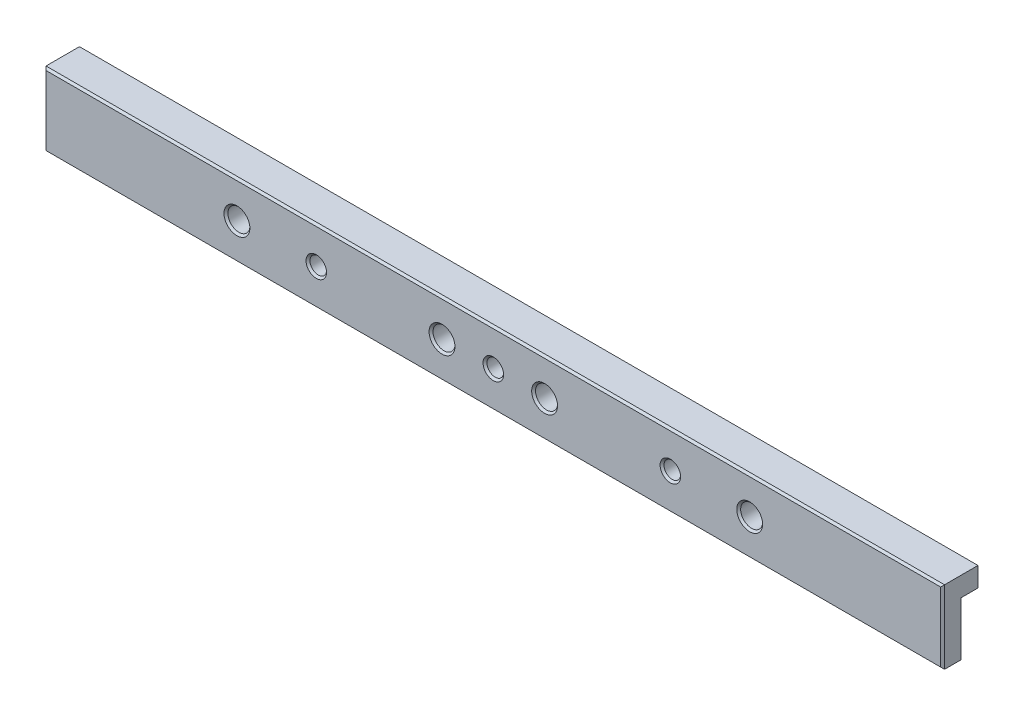
from build123d import *

# Parameters (mm, degrees)
SKETCH1_W               = 184
SKETCH1_H               = 15
BOSS_EXTRUDE1_DEPTH     = 7.25
CUT_EXTRUDE1_START      = -7.25
SKETCH1_6_W             = 184
SKETCH1_6_H             = 11
CUT_EXTRUDE1_DEPTH      = 3.5
CUT_EXTRUDE2_DEPTH      = 93.589483744
CUT_EXTRUDE2_DEPTH_BACK = 93.589483744
SKETCH2_R               = 2.25
SKETCH2_R_2             = 1.7
CHAMFER1_SIZE           = 0.4


with BuildPart() as part:
    # Sketch1 → Boss-Extrude1 (new body)
    with BuildSketch(Plane.XY):
        Rectangle(SKETCH1_W, SKETCH1_H)
    extrude(amount=-BOSS_EXTRUDE1_DEPTH)

    # Sketch1<6> → Cut-Extrude1 (cut)
    with BuildSketch(Plane.XY.offset(CUT_EXTRUDE1_START)):
        with Locations((0, -2)):
            Rectangle(SKETCH1_6_W, SKETCH1_6_H)
    extrude(amount=CUT_EXTRUDE1_DEPTH, mode=Mode.SUBTRACT)

    # Sketch2 → Cut-Extrude2 (cut, two sides: drawn at the far end of the back side and taken through both)
    with BuildSketch(Plane.XY.offset(-CUT_EXTRUDE2_DEPTH_BACK)):
        with Locations((-52.5, 0)):
            Circle(SKETCH2_R)
        with Locations((-36.25, 0)):
            Circle(SKETCH2_R_2)
        with Locations((-10.5, 0)):
            Circle(SKETCH2_R)
        Circle(SKETCH2_R_2)
        with Locations((10.5, 0)):
            Circle(SKETCH2_R)
        with Locations((36.25, 0)):
            Circle(SKETCH2_R_2)
        with Locations((52.5, 0)):
            Circle(SKETCH2_R)
    extrude(amount=CUT_EXTRUDE2_DEPTH + CUT_EXTRUDE2_DEPTH_BACK, mode=Mode.SUBTRACT)

    # Chamfer1
    chamfer1_edges = [part.edges().sort_by_distance(p)[0] for p in [
        (-54.75, 0, 0),
        (-37.95, 0, 0),
        (-12.75, 0, 0),
        (-1.7, 0, 0),
        (8.25, 0, 0),
        (34.55, 0, 0),
        (50.25, 0, 0),
        (0, -7.5, 0),
        (-92, 0, 0),
        (0, 7.5, 0),
        (92, 0, 0),
    ]]
    chamfer(chamfer1_edges, length=CHAMFER1_SIZE)


solid = part.part
